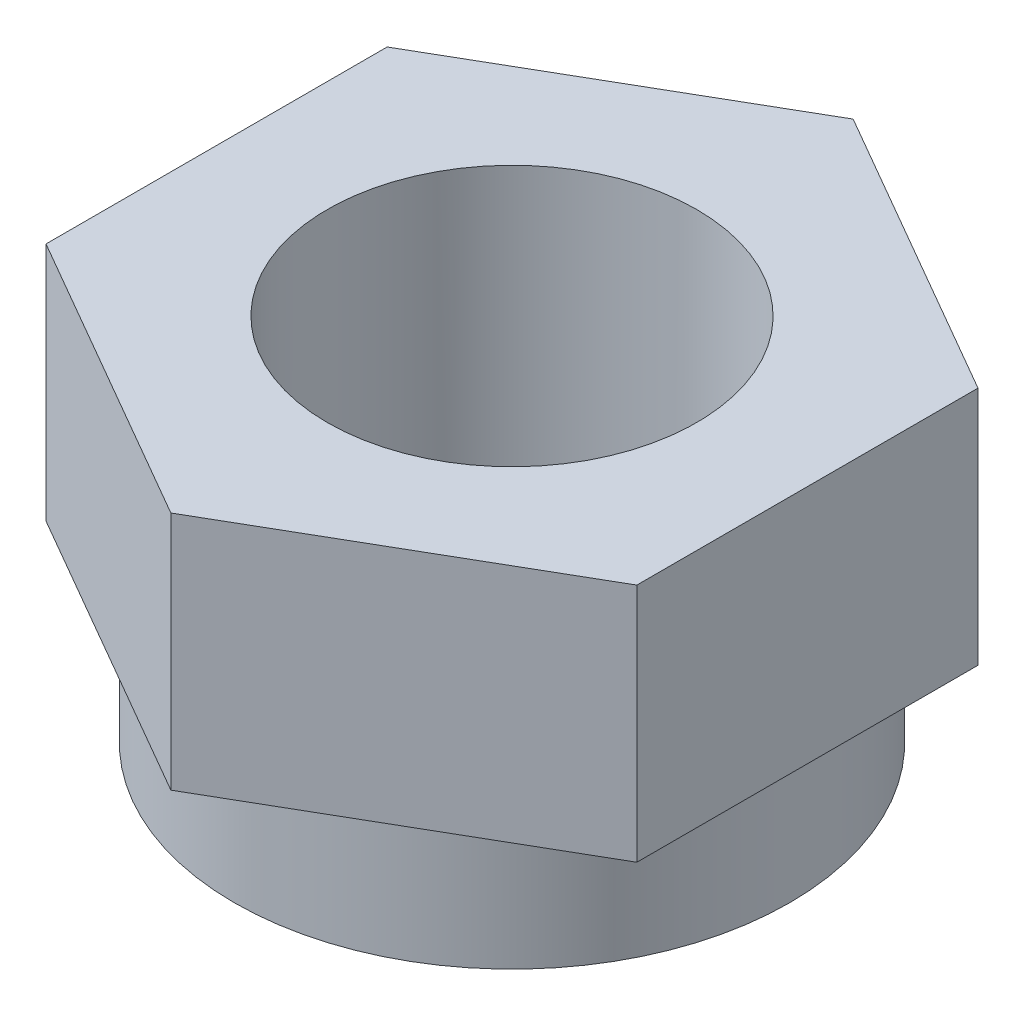
from build123d import *

# Parameters (mm, degrees)
BOSS_EXTRUDE1_DEPTH     = 3.25
SKETCH2_R               = 3.76
BOSS_EXTRUDE2_DEPTH     = 1.75
CUT_EXTRUDE1_DEPTH      = 8.895146188
CUT_EXTRUDE1_DEPTH_BACK = 8.895146188
SKETCH3_R               = 2.5


with BuildPart() as part:
    # Sketch1 → Boss-Extrude1 (new body)
    with BuildSketch(Plane(origin=(0, 0, 0), x_dir=(1, 0, 0), z_dir=(0, 1, 0))):
        Polygon((4, -2.309401077), (0, -4.618802154), (-4, -2.309401077), (-4, 2.309401077), (0, 4.618802154), (4, 2.309401077), align=None)
    extrude(amount=-BOSS_EXTRUDE1_DEPTH)

    # Sketch2 → Boss-Extrude2 (add)
    with BuildSketch(Plane(origin=(0, -3.25, 0), x_dir=(1, 0, 0), z_dir=(0, 1, 0))):
        with Locations(Location((0, 0, 0), (0, 0, 270))):
            Circle(SKETCH2_R)
    extrude(amount=-BOSS_EXTRUDE2_DEPTH)

    # Sketch3 → Cut-Extrude1 (cut, two sides: drawn at the far end of the back side and taken through both)
    with BuildSketch(Plane(origin=(0, 0, 0), x_dir=(1, 0, 0), z_dir=(0, 1, 0)).offset(-CUT_EXTRUDE1_DEPTH_BACK)):
        with Locations(Location((0, 0, 0), (0, 0, 270))):
            Circle(SKETCH3_R)
    extrude(amount=CUT_EXTRUDE1_DEPTH + CUT_EXTRUDE1_DEPTH_BACK, mode=Mode.SUBTRACT)


solid = part.part
